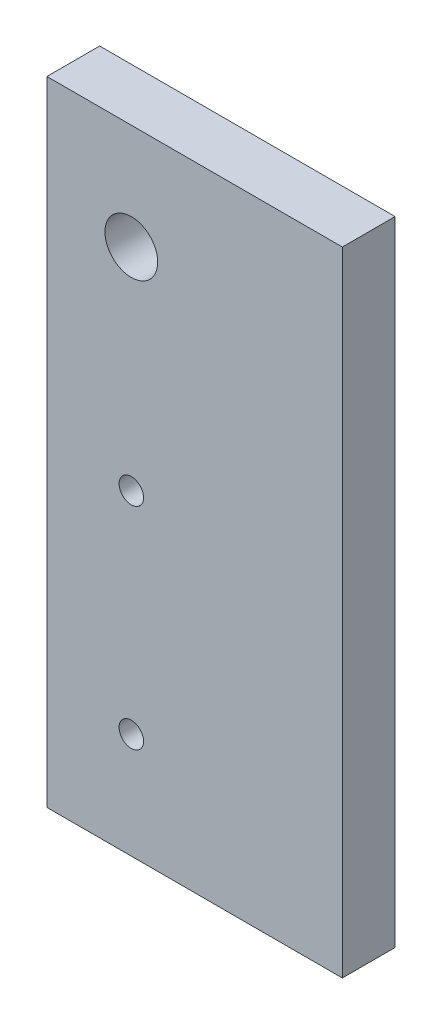
from build123d import *

# Parameters (mm, degrees)
SKETCH1_W           = 35.56
SKETCH1_H           = 76.2
BOSS_EXTRUDE1_DEPTH = 6.35
SKETCH3_R           = 3.175
SKETCH3_R_2         = 1.4732
CUT_EXTRUDE1_DEPTH  = 85.328382529


with BuildPart() as part:
    # Sketch1 → Boss-Extrude1 (new body)
    with BuildSketch(Plane.XY):
        with Locations((17.78, 38.1)):
            Rectangle(SKETCH1_W, SKETCH1_H)
    extrude(amount=BOSS_EXTRUDE1_DEPTH)

    # Sketch3 → Cut-Extrude1 (cut, through all)
    with BuildSketch(Plane.XY.offset(6.35)):
        with Locations((10.16, 63.5)):
            Circle(SKETCH3_R)
        with Locations((10.16, 38.1)):
            Circle(SKETCH3_R_2)
        with Locations((10.16, 12.7)):
            Circle(SKETCH3_R_2)
    extrude(amount=-CUT_EXTRUDE1_DEPTH, mode=Mode.SUBTRACT)


solid = part.part
